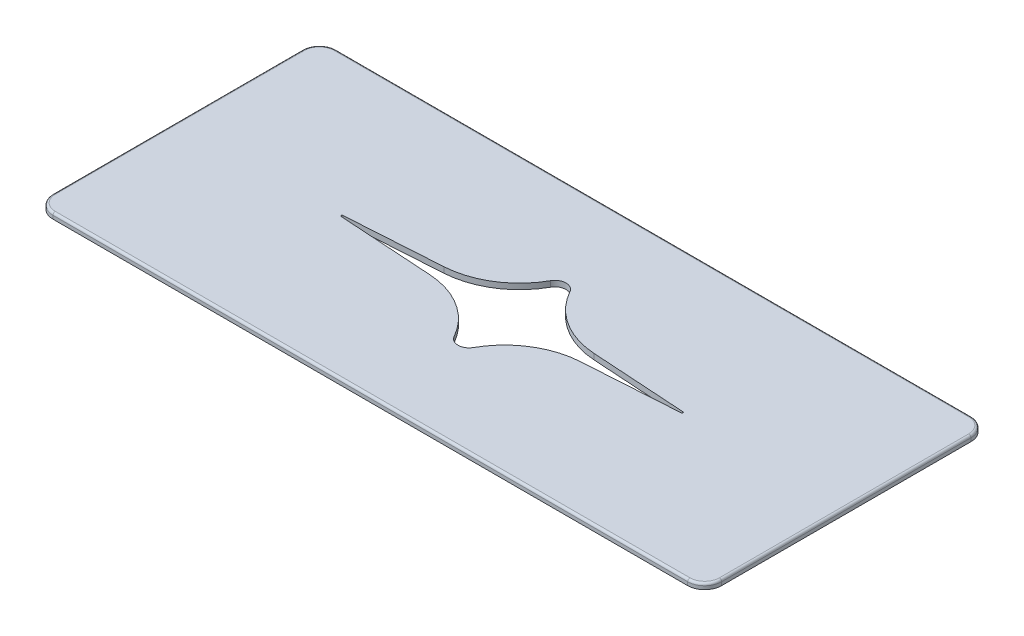
from build123d import *

# Parameters (mm, degrees)
SKETCH1_W           = 295
SKETCH1_H           = 125
BOSS_EXTRUDE1_DEPTH = 2.5
FILLET1_R           = 7.5
FILLET2_R           = 1
CUT_EXTRUDE4_DEPTH  = 10


with BuildPart() as part:
    # Sketch1 → Boss-Extrude1 (new body)
    with BuildSketch(Plane(origin=(0, 0, 0), x_dir=(1, 0, 0), z_dir=(0, 1, 0))):
        Rectangle(SKETCH1_W, SKETCH1_H)
    extrude(amount=BOSS_EXTRUDE1_DEPTH)

    # Fillet1
    fillet1_edges = [part.edges().sort_by_distance(p)[0] for p in [
        (147.5, 1.25, 62.5),
        (-147.5, 1.25, 62.5),
        (-147.5, 1.25, -62.5),
        (147.5, 1.25, -62.5),
    ]]
    fillet(fillet1_edges, radius=FILLET1_R)

    # Fillet2
    fillet2_edges = [part.edges().sort_by_distance(p)[0] for p in [
        (147.5, 2.5, 0),
        (0, 2.5, 62.5),
        (0, 2.5, -62.5),
        (-147.5, 2.5, 0),
        (-145.303300859, 2.5, -60.303300859),
        (145.303300859, 2.5, -60.303300859),
        (-145.303300859, 2.5, 60.303300859),
        (145.303300859, 2.5, 60.303300859),
    ]]
    fillet(fillet2_edges, radius=FILLET2_R)

    # Sketch4 → Cut-Extrude4 (cut)
    with BuildSketch(Plane(origin=(0, 2.5, 0), x_dir=(1, 0, 0), z_dir=(0, 1, 0))):
        with BuildLine():
            Line((-33.073998348, 3.090010623), (-75.025380216, 0.395089537))
            ThreePointArc((-75.025380216, 0.395089537), (-75.3959039, 0), (-75.025380216, -0.395089537))
            Line((-75.025380216, -0.395089537), (-33.073998348, -3.090010623))
            ThreePointArc((-33.073998348, -3.090010623), (-16.332033074, -8.52386445), (-4.236704547, -21.311483324))
            ThreePointArc((-4.236704547, -21.311483324), (0, -23.802100242), (4.236704547, -21.311483324))
            ThreePointArc((4.236704547, -21.311483324), (16.332033074, -8.52386445), (33.073998348, -3.090010623))
            Line((33.073998348, -3.090010623), (75.025380216, -0.395089537))
            ThreePointArc((75.025380216, -0.395089537), (75.3959039, 0), (75.025380216, 0.395089537))
            Line((75.025380216, 0.395089537), (33.073998348, 3.090010623))
            ThreePointArc((33.073998348, 3.090010623), (16.332033074, 8.52386445), (4.236704547, 21.311483324))
            ThreePointArc((4.236704547, 21.311483324), (0, 23.802100242), (-4.236704547, 21.311483324))
            ThreePointArc((-4.236704547, 21.311483324), (-16.332033074, 8.52386445), (-33.073998348, 3.090010623))
        make_face()
    extrude(amount=-CUT_EXTRUDE4_DEPTH, mode=Mode.SUBTRACT)


solid = part.part
